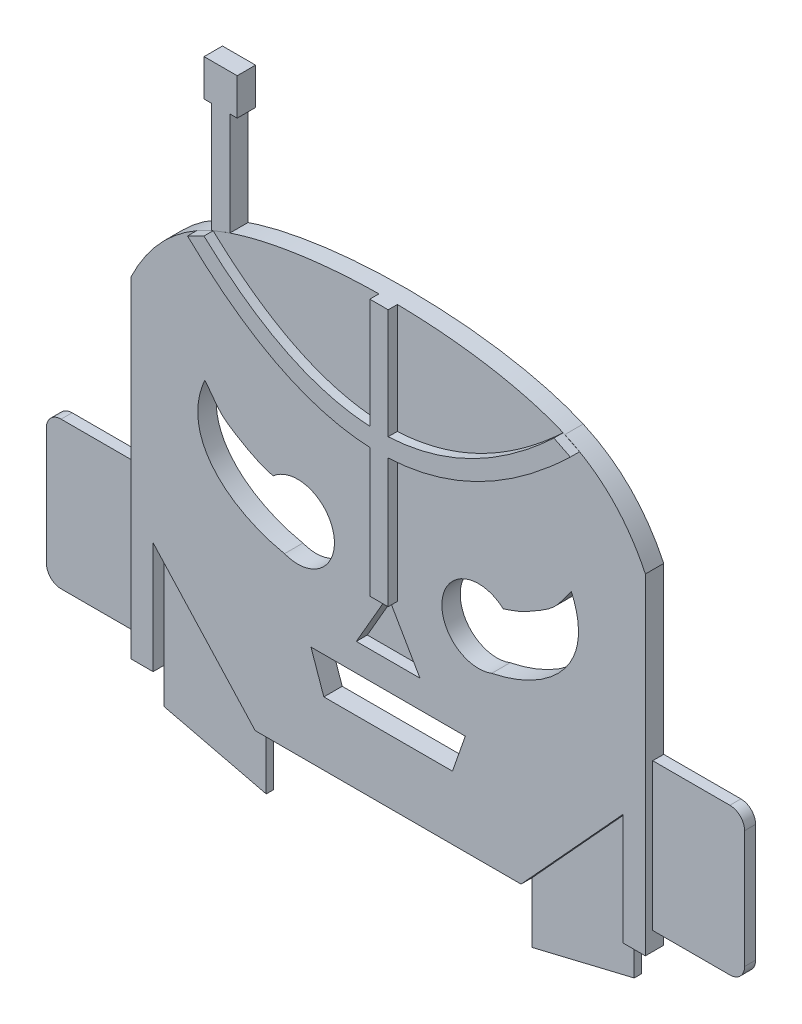
from build123d import *

# Parameters (mm, degrees)
SALIENTE_EXTRUIR1_DEPTH    = 0.5
SALIENTE_EXTRUIR3_DEPTH    = 0.25
CROQUIS3_W                 = 2.5
CROQUIS3_H                 = 4
CORTAR_EXTRUIR1_DEPTH      = 0.2
CORTAR_EXTRUIR2_DEPTH      = 16.044499449
CORTAR_EXTRUIR3_DEPTH      = 0.3
CROQUIS6_W                 = 0.5
CROQUIS6_H                 = 0.5
SALIENTE_EXTRUIR4_DEPTH    = 0.5
SALIENTE_EXTRUIR5_DEPTH    = 0.5
CORTAR_EXTRUIR4_DEPTH      = 0.3
CORTAR_EXTRUIR6_DEPTH      = 17.351359419
CORTAR_EXTRUIR6_DEPTH_BACK = 17.351359419


with BuildPart() as part:
    # Croquis1 → Saliente-Extruir1 (new body)
    with BuildSketch(Plane.XY):
        with BuildLine():
            add(Edge.make_bspline(
                [(-7, -2.654911382), (-6.43729165, -1.477773663), (-5.459968138, -0.823437035)],
                knots=[0, 0, 0, 0.697899527, 0.697899527, 0.697899527], degree=2))
            Line((-7, -2.654911382), (-7, -7.154911382))
            Line((-7, -7.154911382), (-7, -11.154911382))
            Line((-7, -11.154911382), (-7, -11.654911382))
            Line((-7, -11.654911382), (7, -11.654911382))
            Line((7, -11.654911382), (7, -2.654911382))
            add(Edge.make_bspline(
                [(7, -2.654911382), (6.4475595, -1.500710504), (5.493472653, -0.847655691)],
                knots=[0, 0, 0, 0.686055161, 0.686055161, 0.686055161], degree=2))
            add(Edge.make_bspline(
                [(5.493472653, -0.847655691), (5.133927957, -0.601553992), (4.717344015, -0.426621853)],
                knots=[0.686055161, 0.686055161, 0.686055161, 0.94459294, 0.94459294, 0.94459294], degree=2))
            add(Edge.make_bspline(
                [(4.717344015, -0.426621853), (4.629325683, -0.390064605), (4.536168631, -0.354911382)],
                knots=[0.711833375, 0.711833375, 0.711833375, 0.762765806, 0.762765806, 0.762765806], degree=2, weights=[0.869674597, 0.859955694, 0.850817623]))
            add(Edge.make_bspline(
                [(4.536168631, -0.354911382), (0, 1.356831766), (-4.536168631, -0.354911382)],
                knots=[0.762765806, 0.762765806, 0.762765806, 2.379801035, 2.379801035, 2.379801035], degree=2, weights=[0.850817623, 0.560696315, 0.856038911]))
            add(Edge.make_bspline(
                [(-4.536168631, -0.354911382), (-4.678190069, -0.408503796), (-4.808150811, -0.465309533)],
                knots=[2.379801035, 2.379801035, 2.379801035, 2.458391875, 2.458391875, 2.458391875], degree=2, weights=[0.856038911, 0.870393096, 0.886130226]))
            add(Edge.make_bspline(
                [(-5.459968138, -0.823437035), (-5.15433365, -0.618808948), (-4.808150811, -0.465309533)],
                knots=[0.697899527, 0.697899527, 0.697899527, 0.916150865, 0.916150865, 0.916150865], degree=2))
        make_face()
        with BuildLine():
            Line((-7, -11.154911382), (-7, -7.154911382))
            Line((-7, -7.154911382), (-9.1, -7.154911382))
            ThreePointArc((-9.1, -7.154911382), (-9.382842712, -7.27206867), (-9.5, -7.554911382))
            Line((-9.5, -7.554911382), (-9.5, -10.754911382))
            ThreePointArc((-9.5, -10.754911382), (-9.382842712, -11.037754095), (-9.1, -11.154911382))
            Line((-9.1, -11.154911382), (-7, -11.154911382))
        make_face()
    saliente_extruir1 = extrude(amount=SALIENTE_EXTRUIR1_DEPTH)

    # Croquis2 → Saliente-Extruir3 (add)
    with BuildSketch(Plane.XY.offset(0.5)):
        with BuildLine():
            add(Edge.make_bspline(
                [(-5.209274341, -0.668087715), (-2.729702745, -3.055789139), (-0.25, -3.170426724)],
                knots=[0, 0, 0, 0.476040387, 0.476040387, 0.476040387], degree=2))
            Line((-0.25, -3.170426724), (-0.25, -2.670058896))
            add(Edge.make_bspline(
                [(-4.761570767, -0.44546357), (-2.505785384, -2.559085938), (-0.25, -2.670058896)],
                knots=[0, 0, 0, 0.473748159, 0.473748159, 0.473748159], degree=2))
            Line((-4.761570767, -0.44546357), (-5.209274341, -0.668087715))
        make_face()
        with BuildLine():
            Line((0.25, -2.670058896), (0.25, -3.170437695))
            add(Edge.make_bspline(
                [(0.25, -3.170437695), (2.729328728, -3.055926808), (5.208788565, -0.669061964)],
                knots=[0.524033953, 0.524033953, 0.524033953, 1, 1, 1], degree=2))
            Line((5.208788565, -0.669061964), (4.761570767, -0.44546357))
            add(Edge.make_bspline(
                [(0.25, -2.670058896), (2.505785384, -2.559085938), (4.761570767, -0.44546357)],
                knots=[0.526251841, 0.526251841, 0.526251841, 1, 1, 1], degree=2))
        make_face()
        with BuildLine():
            Line((-0.25, -3.170426724), (-0.25, -6.676208248))
            Line((-0.25, -6.676208248), (0.25, -6.676208248))
            Line((0.25, -6.676208248), (0.25, -3.170437695))
            add(Edge.make_bspline(
                [(-0.25, -3.170426724), (-6.67e-07, -3.181984287), (0.25, -3.170437695)],
                knots=[0.476040387, 0.476040387, 0.476040387, 0.524033953, 0.524033953, 0.524033953], degree=2))
        make_face()
        with BuildLine():
            Line((-0.25, 0.322083073), (-0.25, -2.670058896))
            add(Edge.make_bspline(
                [(-0.25, -2.670058896), (0, -2.682357601), (0.25, -2.670058896)],
                knots=[0.473748159, 0.473748159, 0.473748159, 0.526251841, 0.526251841, 0.526251841], degree=2))
            Line((0.25, -2.670058896), (0.25, 0.322083073))
            add(Edge.make_bspline(
                [(0.25, 0.322083073), (0.125054487, 0.323791745), (9.86e-07, 0.323791752)],
                knots=[1.53302484, 1.53302484, 1.53302484, 1.571666911, 1.571666911, 1.571666911], degree=2, weights=[0.806098269, 0.805646815, 0.805543419]))
            add(Edge.make_bspline(
                [(9.86e-07, 0.323791752), (-0.125053501, 0.323791758), (-0.25, 0.322083073)],
                knots=[1.571666911, 1.571666911, 1.571666911, 1.61029937, 1.61029937, 1.61029937], degree=2, weights=[0.805543419, 0.805440049, 0.805684563]))
        make_face()
        with BuildLine():
            Line((-0.25, -2.670058896), (-0.25, -3.170426724))
            add(Edge.make_bspline(
                [(-0.25, -3.170426724), (-6.67e-07, -3.181984287), (0.25, -3.170437695)],
                knots=[0.476040387, 0.476040387, 0.476040387, 0.524033953, 0.524033953, 0.524033953], degree=2))
            Line((0.25, -3.170437695), (0.25, -2.670058896))
            add(Edge.make_bspline(
                [(-0.25, -2.670058896), (0, -2.682357601), (0.25, -2.670058896)],
                knots=[0.473748159, 0.473748159, 0.473748159, 0.526251841, 0.526251841, 0.526251841], degree=2))
        make_face()
    extrude(amount=SALIENTE_EXTRUIR3_DEPTH)

    # Croquis3 → Cortar-Extruir1 (cut)
    with BuildSketch(Plane.XY.offset(0.5)):
        with Locations((-8.25, -9.154911382)):
            Rectangle(CROQUIS3_W, CROQUIS3_H)
    cortar_extruir1 = extrude(amount=-CORTAR_EXTRUIR1_DEPTH, mode=Mode.SUBTRACT)

    # Simetría4: Saliente-Extruir1, Cortar-Extruir1 across plane
    add(saliente_extruir1.mirror(Plane(origin=(0, 0, 0), x_dir=(0, 0, 1), z_dir=(1, 0, 0))))
    add(cortar_extruir1.mirror(Plane(origin=(0, 0, 0), x_dir=(0, 0, 1), z_dir=(1, 0, 0))), mode=Mode.SUBTRACT)

    # Croquis4 → Cortar-Extruir2 (cut, through all)
    with BuildSketch(Plane.XY.offset(0.5)):
        with BuildLine():
            ThreePointArc((-2.819816225, -7.085512289), (-1.478612147, -5.968150706), (-3.132859694, -5.410664974))
            add(Edge.make_bspline(
                [(-4.985974264, -4.077116226), (-4.656618425, -4.531627284), (-4.528206239, -4.71316852), (-3.588188991, -5.268300344), (-3.515962957, -5.276366331), (-3.132859694, -5.410664974)],
                knots=[0, 0, 0, 0, 0.376187305, 0.476187305, 1, 1, 1, 1], degree=3))
            add(Edge.make_bspline(
                [(-2.819816225, -7.085512289), (-4.318509024, -6.781423826), (-5.701470772, -5.678827367), (-4.985974264, -4.077116226)],
                knots=[0, 0, 0, 0, 1, 1, 1, 1], degree=3))
        make_face()
    cortar_extruir2 = extrude(amount=-CORTAR_EXTRUIR2_DEPTH, mode=Mode.SUBTRACT)

    # Croquis5 → Cortar-Extruir3 (cut)
    with BuildSketch(Plane.XY.offset(0.5)):
        Polygon((0.866025404, -8.176208248), (0, -6.676208248), (-0.866025404, -8.176208248), align=None)
        Polygon((-2.1, -8.926208248), (2.1, -8.926208248), (1.75, -9.926208248), (-1.75, -9.926208248), align=None)
    extrude(amount=-CORTAR_EXTRUIR3_DEPTH, mode=Mode.SUBTRACT)

    # Croquis7 → Saliente-Extruir5 (add)
    with BuildSketch(Plane.XY.offset(0.5)):
        Polygon((-6.396790084, -8.616522375), (-6.396790084, -12.627419512), (-3.617369223, -13.297159478), (-3.617369223, -11.654911382), align=None)
    saliente_extruir5 = extrude(amount=-SALIENTE_EXTRUIR5_DEPTH)

    # Croquis8 → Cortar-Extruir4 (cut)
    with BuildSketch(Plane.XY.offset(0.5)):
        Polygon((-6.396790084, -12.627419512), (-3.617369223, -13.297159478), (-3.617369223, -11.654911382), (-6.396790084, -8.616522375), align=None)
    cortar_extruir4 = extrude(amount=-CORTAR_EXTRUIR4_DEPTH, mode=Mode.SUBTRACT)

    # Simetría3: Cortar-Extruir2, Saliente-Extruir5, Cortar-Extruir4 across plane
    add(cortar_extruir2.mirror(Plane(origin=(0, 0, 0), x_dir=(0, 0, 1), z_dir=(1, 0, 0))), mode=Mode.SUBTRACT)
    add(saliente_extruir5.mirror(Plane(origin=(0, 0, 0), x_dir=(0, 0, 1), z_dir=(1, 0, 0))))
    add(cortar_extruir4.mirror(Plane(origin=(0, 0, 0), x_dir=(0, 0, 1), z_dir=(1, 0, 0))), mode=Mode.SUBTRACT)

    # Croquis10 → Cortar-Extruir6 (cut, two sides: drawn at the far end of the back side and taken through both)
    with BuildSketch(Plane.XY.offset(0.2).offset(-CORTAR_EXTRUIR6_DEPTH_BACK)):
        Polygon((-1.75, -9.926208248), (1.75, -9.926208248), (2.1, -8.926208248), (-2.1, -8.926208248), align=None)
    extrude(amount=CORTAR_EXTRUIR6_DEPTH + CORTAR_EXTRUIR6_DEPTH_BACK, mode=Mode.SUBTRACT)


with BuildPart() as body_2:
    # Croquis6 → Saliente-Extruir4 (new body)
    with BuildSketch(Plane.XY.offset(0.5)):
        with BuildLine():
            Line((-4.808150811, 2.534690467), (-4.808150811, -0.465309533))
            add(Edge.make_bspline(
                [(-4.808150811, -0.465309533), (-4.587296252, -0.368045953), (-4.308150811, -0.273574887)],
                knots=[0, 0, 0, 0.301704939, 0.301704939, 0.301704939], degree=2))
            Line((-4.308150811, -0.273574887), (-4.308150811, 2.534690467))
            Line((-4.308150811, 2.534690467), (-4.808150811, 2.534690467))
        make_face()
        Polygon((-5.008150811, 2.534690467), (-4.808150811, 2.534690467), (-4.808150811, 3.034690467), (-4.308150811, 3.034690467), (-4.308150811, 2.534690467), (-4.108150811, 2.534690467), (-4.108150811, 3.534690467), (-5.008150811, 3.534690467), align=None)
        with Locations((-4.558150811, 2.784690467)):
            Rectangle(CROQUIS6_W, CROQUIS6_H)
    extrude(amount=-SALIENTE_EXTRUIR4_DEPTH)


solid = Compound([part.part, body_2.part])
